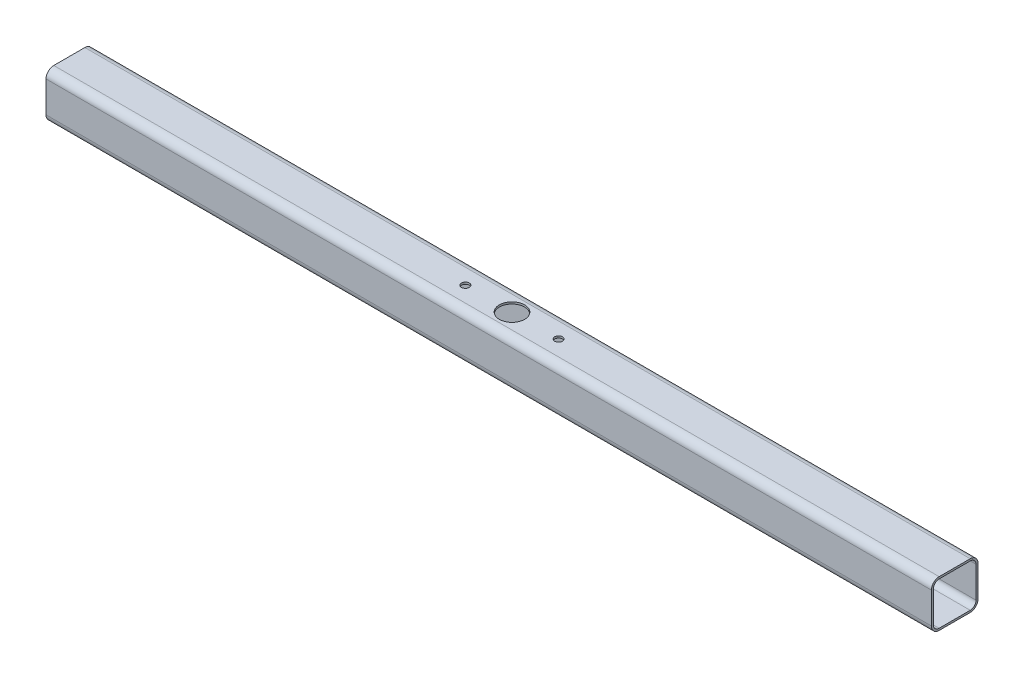
from build123d import *

# Parameters (mm, degrees)
STRUCTURAL_MEMBER1_DEPTH       = 1447.8
SKETCH12_R                     = 20.6375
CUT_EXTRUDE1_DEPTH             = 1451.304412873
F_1_2_0_5_DIAMETER_HOLE1_D     = 12.7
F_1_2_0_5_DIAMETER_HOLE1_DEPTH = 25.4
F_1_2_0_5_DIAMETER_HOLE1_TIP   = 3.815464931


with BuildPart() as part:
    # Sketch11 → Structural Member1 (new body)
    with BuildSketch(Plane(origin=(0, 0, 0), x_dir=(0, -1, 0), z_dir=(-1, 0, 0))):
        with BuildLine():
            Line((-25.4, -38.1), (25.4, -38.1))
            ThreePointArc((25.4, -38.1), (34.380256121, -34.380256121), (38.1, -25.4))
            Line((38.1, -25.4), (38.1, 25.4))
            ThreePointArc((38.1, 25.4), (34.380256121, 34.380256121), (25.4, 38.1))
            Line((25.4, 38.1), (-25.4, 38.1))
            ThreePointArc((-25.4, 38.1), (-34.380256121, 34.380256121), (-38.1, 25.4))
            Line((-38.1, 25.4), (-38.1, -25.4))
            ThreePointArc((-38.1, -25.4), (-34.380256121, -34.380256121), (-25.4, -38.1))
        make_face()
        with BuildLine():
            Line((-25.4, -34.925), (25.4, -34.925))
            ThreePointArc((25.4, -34.925), (32.135192091, -32.135192091), (34.925, -25.4))
            Line((34.925, -25.4), (34.925, 25.4))
            ThreePointArc((34.925, 25.4), (32.135192091, 32.135192091), (25.4, 34.925))
            Line((25.4, 34.925), (-25.4, 34.925))
            ThreePointArc((-25.4, 34.925), (-32.135192091, 32.135192091), (-34.925, 25.4))
            Line((-34.925, 25.4), (-34.925, -25.4))
            ThreePointArc((-34.925, -25.4), (-32.135192091, -32.135192091), (-25.4, -34.925))
        make_face(mode=Mode.SUBTRACT)
    extrude(amount=STRUCTURAL_MEMBER1_DEPTH)

    # Sketch12 → Cut-Extrude1 (cut, through all)
    with BuildSketch(Plane(origin=(0, 38.1, 0), x_dir=(1, 0, 0), z_dir=(0, 1, 0))):
        with Locations(Location((-723.9, 0, 0), (0, 0, 180))):
            Circle(SKETCH12_R)
    extrude(amount=-CUT_EXTRUDE1_DEPTH, mode=Mode.SUBTRACT)

    # 1/2 (0.5) Diameter Hole1
    with Locations(Plane(origin=(-800.1, 38.1, 0), x_dir=(0, 0, 1), z_dir=(0, 1, 0))):
        with Locations((0, 0), (0, 152.4)):
            Hole(F_1_2_0_5_DIAMETER_HOLE1_D / 2, depth=F_1_2_0_5_DIAMETER_HOLE1_DEPTH)
            with Locations((0, 0, -(F_1_2_0_5_DIAMETER_HOLE1_DEPTH + F_1_2_0_5_DIAMETER_HOLE1_TIP / 2))):  # 118° drill point
                Cone(0, F_1_2_0_5_DIAMETER_HOLE1_D / 2, F_1_2_0_5_DIAMETER_HOLE1_TIP, mode=Mode.SUBTRACT)


solid = part.part
